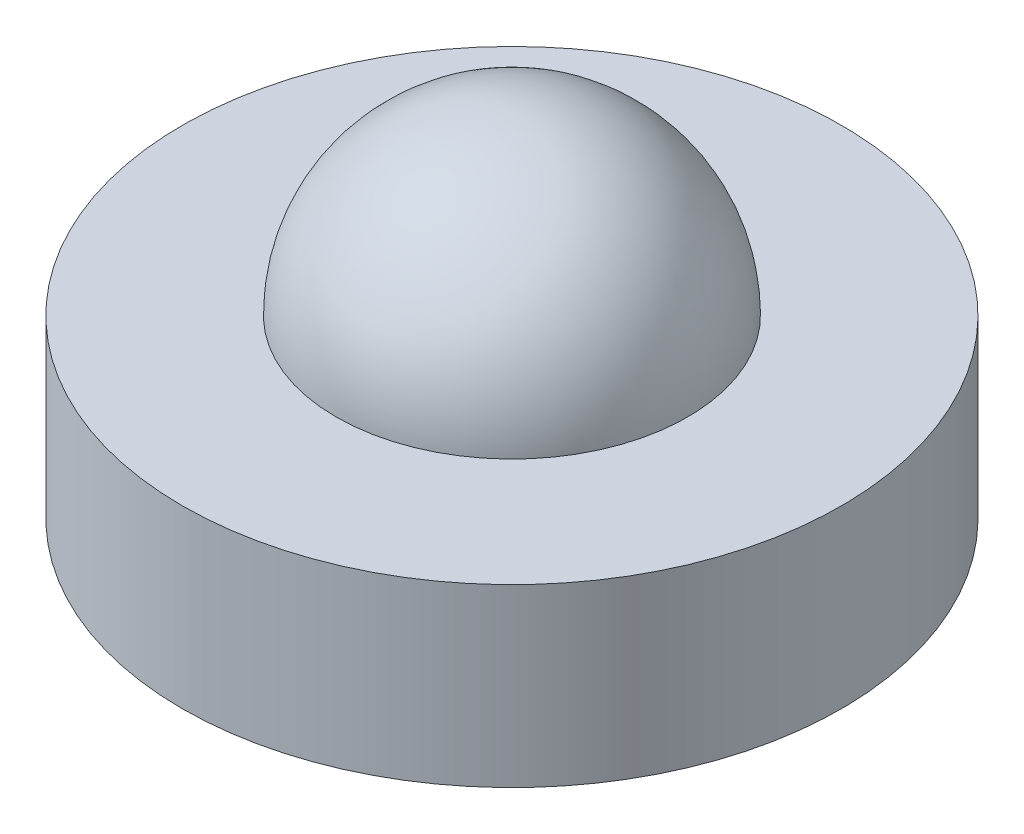
from build123d import *

# Parameters (mm, degrees)
SKETCH1_R               = 3.75
BOSS_EXTRUDE1_DEPTH     = 2
CUT_EXTRUDE1_DEPTH      = 7.642665128
CUT_EXTRUDE1_DEPTH_BACK = 7.642665128
SKETCH3_W               = 4
SKETCH3_H               = 2


with BuildPart() as part:
    # Sketch1 → Boss-Extrude1 (new body)
    with BuildSketch(Plane(origin=(0, 0, 0), x_dir=(1, 0, 0), z_dir=(0, 1, 0))):
        with Locations(Location((0, 0, 0), (0, 0, 270))):
            Circle(SKETCH1_R)
    extrude(amount=BOSS_EXTRUDE1_DEPTH)


with BuildPart() as body_2:
    # Sketch2 → Revolve6 (revolve)
    with BuildSketch(Plane(origin=(0, 2, 0), x_dir=(1, 0, 0), z_dir=(0, 1, 0))):
        with BuildLine():
            Line((-2, 0), (2, 0))
            ThreePointArc((2, 0), (0, 2), (-2, 0))
        make_face()
    revolve(axis=Axis((2.864015087, 2, 0), (1, 0, 0)))

    # Sketch3 → Cut-Extrude1 (cut, two sides: drawn at the far end of the back side and taken through both)
    with BuildSketch(Plane.XY.offset(-CUT_EXTRUDE1_DEPTH_BACK)):
        with Locations((0, 1)):
            Rectangle(SKETCH3_W, SKETCH3_H)
    extrude(amount=CUT_EXTRUDE1_DEPTH + CUT_EXTRUDE1_DEPTH_BACK, mode=Mode.SUBTRACT)


solid = Compound([part.part, body_2.part])
